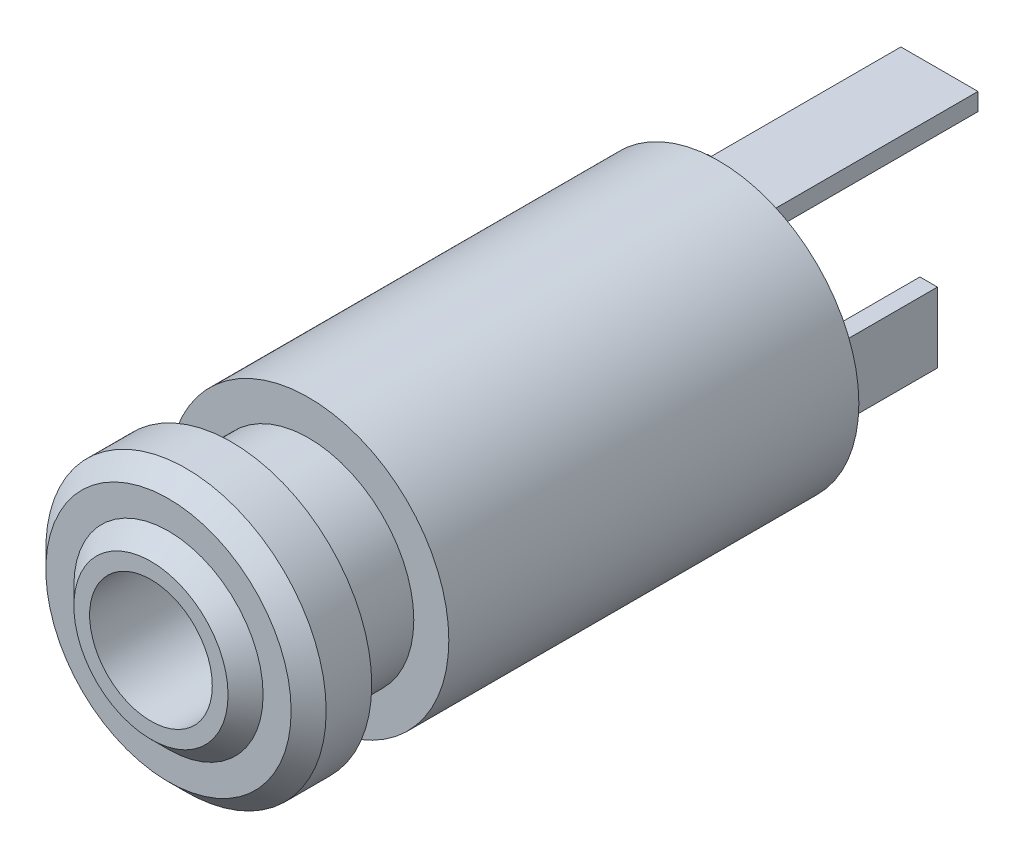
from build123d import *

# Parameters (mm, degrees)
BOSS_EXTRUDE1_START = -2.3
SKETCH2_R           = 4
SKETCH2_R_2         = 2.6
BOSS_EXTRUDE1_DEPTH = 1.8
CHAMFER1_SIZE       = 0.5
SKETCH3_W           = 0.5
SKETCH3_H           = 2
SKETCH3_W_2         = 2.2
SKETCH3_H_2         = 0.5
SKETCH3_W_3         = 0.638814793
BOSS_EXTRUDE2_DEPTH = 3
SKETCH4_W           = 2.2
SKETCH4_H           = 0.5
BOSS_EXTRUDE3_DEPTH = 3.3


with BuildPart() as part:
    # Sketch1 → Revolve1 (revolve)
    with BuildSketch(Plane(origin=(0, 0, 0), x_dir=(0, 0, -1), z_dir=(1, 0, 0)), mode=Mode.PRIVATE) as revolve1_sk:
        Polygon((0, 1.75), (0, 2.2), (0.8, 3), (4.5, 3), (4.5, 4), (16.2, 4), (16.2, 0), (13.508423887, 0), (13.508423887, 1.75), align=None)
    revolve(revolve1_sk.sketch.rotate(Axis((0, 0, 3.985074627), (0, 0, -1)), 90), axis=Axis((0, 0, 3.985074627), (0, 0, -1)))

    # Sketch2 → Boss-Extrude1 (add)
    with BuildSketch(Plane.XY.offset(BOSS_EXTRUDE1_START)):
        Circle(SKETCH2_R)
        Circle(SKETCH2_R_2, mode=Mode.SUBTRACT)
    extrude(amount=BOSS_EXTRUDE1_DEPTH)

    # Chamfer1
    chamfer1_edges = [part.edges().sort_by_distance(p)[0] for p in [
        (-4, 0, -0.5),
    ]]
    chamfer(chamfer1_edges, length=CHAMFER1_SIZE)

    # Sketch3 → Boss-Extrude2 (add)
    with BuildSketch(Plane(origin=(0, 0, -16.2), x_dir=(-1, 0, 0), z_dir=(0, 0, -1))):
        with Locations((-2.993209108, 0)):
            Rectangle(SKETCH3_W, SKETCH3_H)
        with Locations((0, 2.862816669)):
            Rectangle(SKETCH3_W_2, SKETCH3_H_2)
        with Locations((2.993209109, 0)):
            Rectangle(SKETCH3_W_3, SKETCH3_H)
    extrude(amount=BOSS_EXTRUDE2_DEPTH)

    # Sketch4 → Boss-Extrude3 (add)
    with BuildSketch(Plane(origin=(0, 0, -19.2), x_dir=(-1, 0, 0), z_dir=(0, 0, -1))):
        with Locations((0, 2.862816669)):
            Rectangle(SKETCH4_W, SKETCH4_H)
    extrude(amount=BOSS_EXTRUDE3_DEPTH)


solid = part.part
